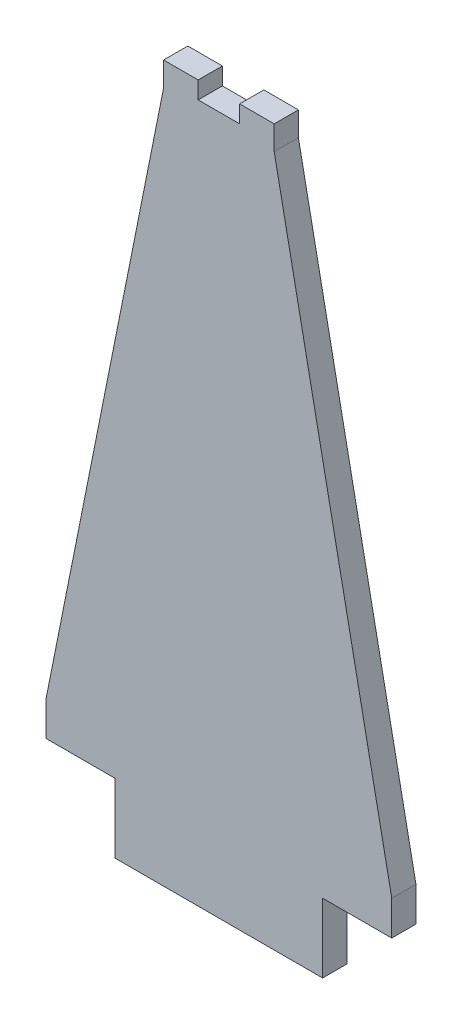
from build123d import *

# Parameters (mm, degrees)
BOSS_EXTRUDE1_DEPTH = 0.175


with BuildPart() as part:
    # frame_outline → Boss-Extrude1 (new, symmetric)
    with BuildSketch(Plane.XY):
        Polygon((0, 0), (3, 0), (3, 1), (4, 1), (4, 1.5), (2.3, 10), (2.3, 10.35), (1.8, 10.35), (1.8, 10.1), (1.2, 10.1), (1.2, 10.35), (0.7, 10.35), (0.7, 10), (-1, 1.5), (-1, 1), (0, 1), align=None)
    extrude(amount=BOSS_EXTRUDE1_DEPTH, both=True)


solid = part.part
